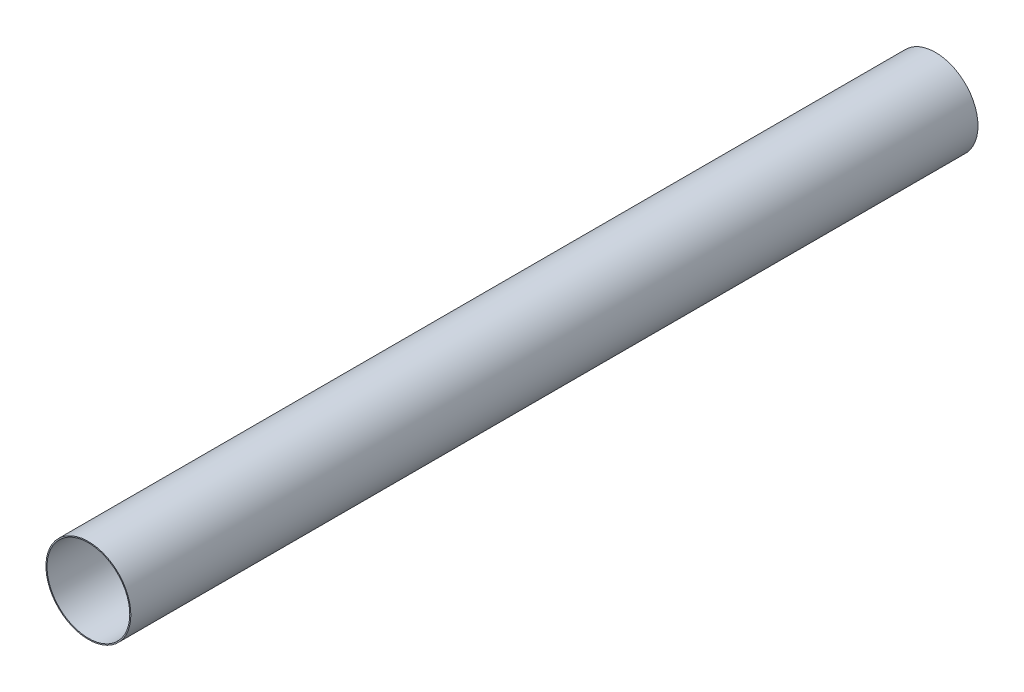
from build123d import *

# Parameters (mm, degrees)
SKETCH1_R           = 78.2
SKETCH1_R_2         = 76.2
BOSS_EXTRUDE1_DEPTH = 1560


with BuildPart() as part:
    # Sketch1 → Boss-Extrude1 (new body)
    with BuildSketch(Plane.XY):
        Circle(SKETCH1_R)
        Circle(SKETCH1_R_2, mode=Mode.SUBTRACT)
    extrude(amount=BOSS_EXTRUDE1_DEPTH)


solid = part.part
